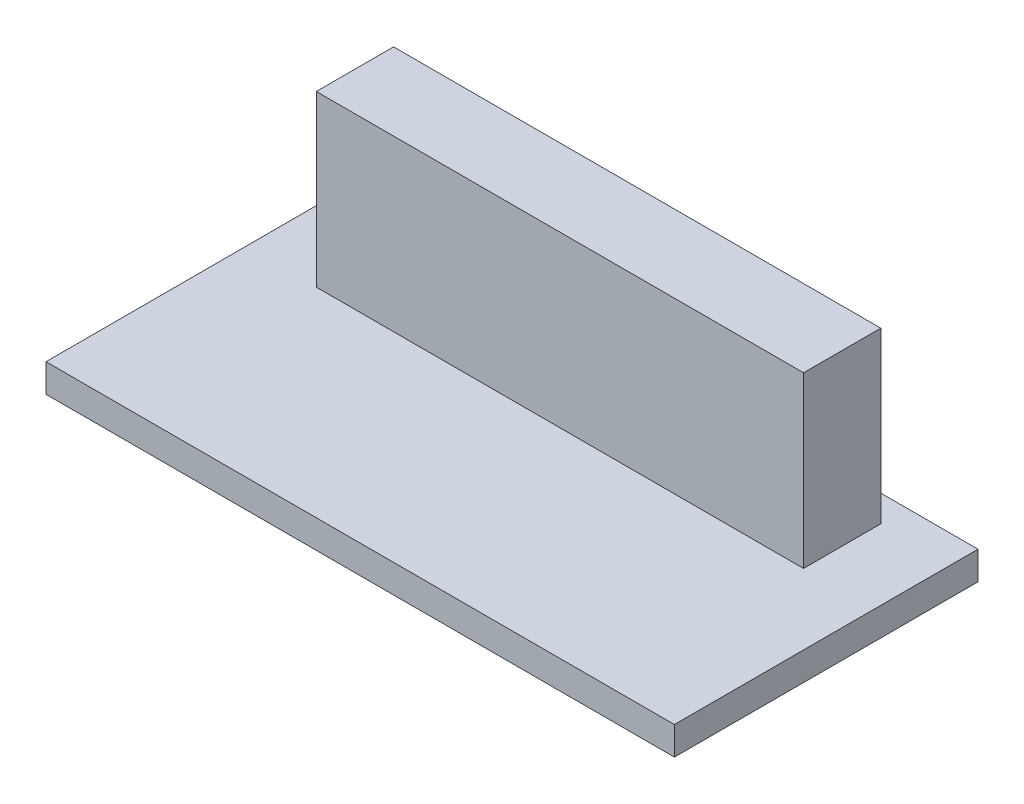
from build123d import *

# Parameters (mm, degrees)
SKETCH1_W           = 44.5
SKETCH1_H           = 21.5
BOSS_EXTRUDE1_DEPTH = 2
SKETCH2_W           = 34.501246382
SKETCH2_H           = 5.47061205
BOSS_EXTRUDE2_DEPTH = 12


with BuildPart() as part:
    # Sketch1 → Boss-Extrude1 (new body)
    with BuildSketch(Plane(origin=(0, 0, 0), x_dir=(1, 0, 0), z_dir=(0, 1, 0))):
        Rectangle(SKETCH1_W, SKETCH1_H)
    extrude(amount=BOSS_EXTRUDE1_DEPTH)

    # Sketch2 → Boss-Extrude2 (add)
    with BuildSketch(Plane(origin=(0, 2, 0), x_dir=(1, 0, 0), z_dir=(0, 1, 0))):
        with Locations((0, 6.12996264)):
            Rectangle(SKETCH2_W, SKETCH2_H)
    extrude(amount=BOSS_EXTRUDE2_DEPTH)


solid = part.part
